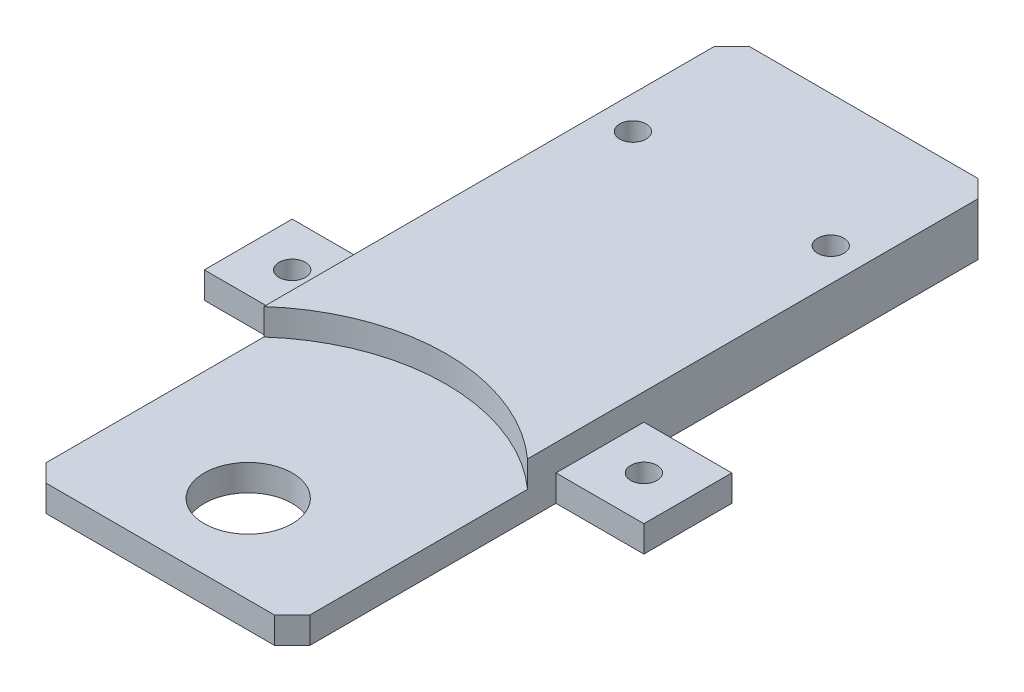
from build123d import *

# Parameters (mm, degrees)
SKETCH1_W                       = 30
SKETCH1_H                       = 80
BOSS_EXTRUDE1_DEPTH             = 3
BOSS_EXTRUDE2_DEPTH             = 3
SKETCH3_R                       = 5
CUT_EXTRUDE1_DEPTH              = 86.492689746
CHAMFER1_SIZE                   = 2
SKETCH4_R                       = 1.5
CUT_EXTRUDE2_DEPTH              = 86.650452421
SKETCH5_W                       = 10
SKETCH5_H                       = 3
BOSS_EXTRUDE3_DEPTH             = 10
F_3_0MM_DOWEL_HOLE1_D           = 3
F_3_0MM_DOWEL_HOLE1_CSINK_D     = 3.05
F_3_0MM_DOWEL_HOLE1_CSINK_ANGLE = 90


with BuildPart() as part:
    # Sketch1 → Boss-Extrude1 (new body)
    with BuildSketch(Plane(origin=(0, 0, 0), x_dir=(1, 0, 0), z_dir=(0, 1, 0))):
        with Locations((15, 40)):
            Rectangle(SKETCH1_W, SKETCH1_H)
    extrude(amount=BOSS_EXTRUDE1_DEPTH)

    # Sketch2 → Boss-Extrude2 (add)
    with BuildSketch(Plane(origin=(0, 3, 0), x_dir=(1, 0, 0), z_dir=(0, 1, 0))):
        with BuildLine():
            Line((15, 80), (0, 80))
            Line((0, 80), (0, 26.770509831))
            ThreePointArc((0, 26.770509831), (6.97150298, 31.018878077), (15, 32.5))
            Line((15, 32.5), (15, 80))
        make_face()
        with BuildLine():
            Line((30, 80), (15, 80))
            Line((15, 80), (15, 32.5))
            ThreePointArc((15, 32.5), (23.02849702, 31.018878077), (30, 26.770509831))
            Line((30, 26.770509831), (30, 80))
        make_face()
    extrude(amount=BOSS_EXTRUDE2_DEPTH)

    # Sketch3 → Cut-Extrude1 (cut, through all)
    with BuildSketch(Plane(origin=(0, 3, 0), x_dir=(1, 0, 0), z_dir=(0, 1, 0))):
        with Locations(Location((15, 10, 0), (0, 0, 270))):
            Circle(SKETCH3_R)
    extrude(amount=-CUT_EXTRUDE1_DEPTH, mode=Mode.SUBTRACT)

    # Chamfer1
    chamfer1_edges = [part.edges().sort_by_distance(p)[0] for p in [
        (0, 3, -80),
        (30, 3, -80),
        (30, 1.5, 0),
        (0, 1.5, 0),
    ]]
    chamfer(chamfer1_edges, length=CHAMFER1_SIZE)

    # Sketch4 → Cut-Extrude2 (cut, through all)
    with BuildSketch(Plane(origin=(0, 6, 0), x_dir=(1, 0, 0), z_dir=(0, 1, 0))):
        with Locations(Location((3.75, 65, 0), (0, 0, 270))):
            Circle(SKETCH4_R)
        with Locations(Location((26.25, 65, 0), (0, 0, 270))):
            Circle(SKETCH4_R)
    extrude(amount=-CUT_EXTRUDE2_DEPTH, mode=Mode.SUBTRACT)

    # Sketch5 → Boss-Extrude3 (add)
    with BuildSketch(Plane.ZY):
        with Locations((-35, 1.5)):
            Rectangle(SKETCH5_W, SKETCH5_H)
    boss_extrude3 = extrude(amount=BOSS_EXTRUDE3_DEPTH)

    # Ø3.0mm Dowel Hole1 (through all)
    with Locations(Plane(origin=(0, 6, 0), x_dir=(1, 0, 0), z_dir=(0, 1, 0))):
        with Locations((-5, 35)):
            f_3_0mm_dowel_hole1 = CounterSinkHole(F_3_0MM_DOWEL_HOLE1_D / 2, F_3_0MM_DOWEL_HOLE1_CSINK_D / 2, counter_sink_angle=F_3_0MM_DOWEL_HOLE1_CSINK_ANGLE)

    # Mirror1: Boss-Extrude3, Ø3.0mm Dowel Hole1 across plane
    add(boss_extrude3.mirror(Plane.ZY.offset(-15)))
    add(f_3_0mm_dowel_hole1.mirror(Plane.ZY.offset(-15)), mode=Mode.SUBTRACT)


solid = part.part
